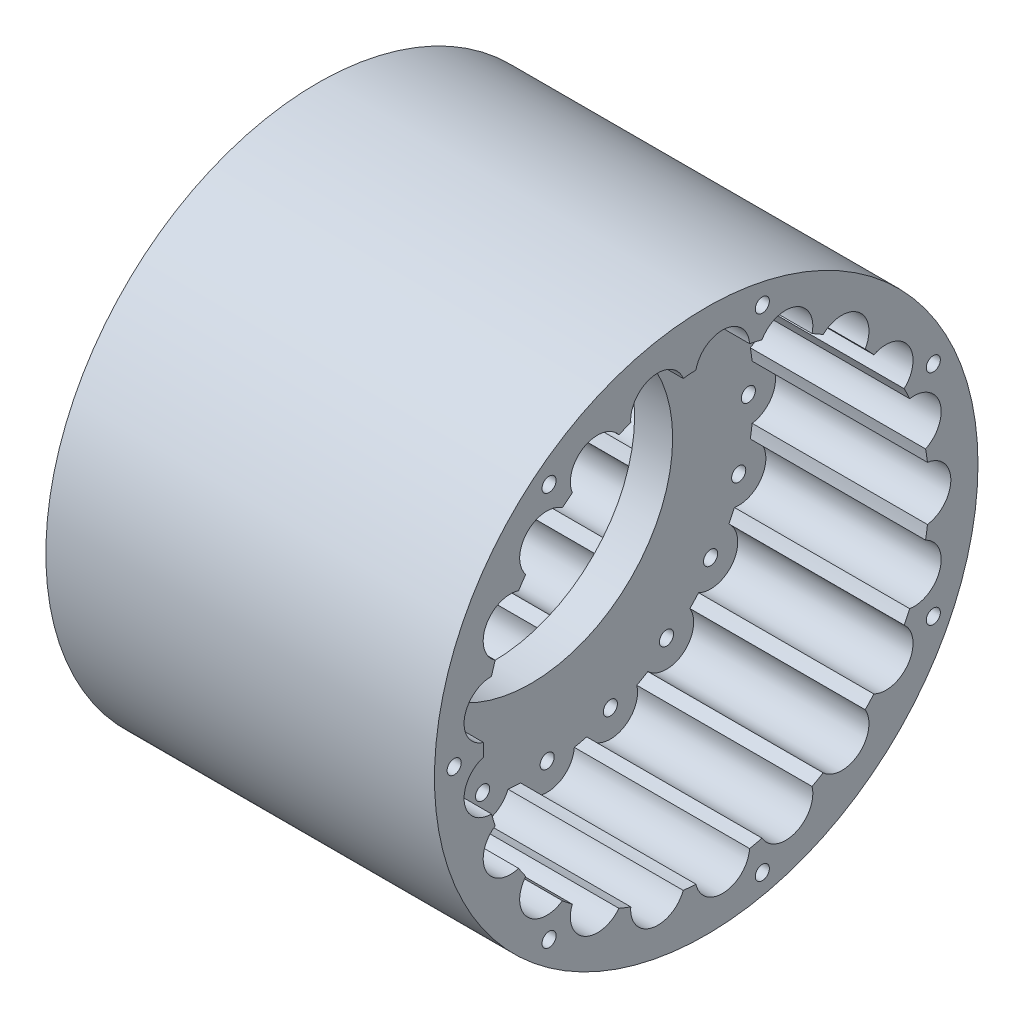
from build123d import *

# Parameters (mm, degrees)
SKIZZE4_R                        = 5
SCHNITT_LINEAR_AUSTRAGEN1_DEPTH  = 32.25
SKIZZE5_R                        = 1.3
SCHNITT_LINEAR_AUSTRAGEN2_DEPTH  = 13
F_2_6_2_6_DURCHMESSER_BOHRUNG1_D = 2.6
KREISMUSTER1_COUNT               = 21


with BuildPart() as part:
    # Skizze2 → Rotation1 (revolve)
    with BuildSketch(Plane.XY, mode=Mode.PRIVATE) as rotation1_sk:
        Polygon((0, 26.075), (3.5, 26.075), (3.5, 41), (35.75, 41), (35.75, 50), (0, 50), align=None)
    rotation1 = revolve(rotation1_sk.sketch.rotate(Axis((0, 0, 0), (-1, 0, 0)), 90), axis=Axis((0, 0, 0), (-1, 0, 0)))

    # Skizze4 → Schnitt-Linear austragen1 (cut)
    with BuildSketch(Plane(origin=(35.75, 0, 0), x_dir=(0, 0, -1), z_dir=(1, 0, 0))):
        with Locations((40, 0)):
            Circle(SKIZZE4_R)
        with Locations((38.222912231, -11.790206976)):
            Circle(SKIZZE4_R)
        with Locations((33.049550973, -22.532802323)):
            Circle(SKIZZE4_R)
        with Locations((24.939592074, -31.273259299)):
            Circle(SKIZZE4_R)
        with Locations((14.613640975, -37.234949946)):
            Circle(SKIZZE4_R)
        with Locations((2.989203743, -39.888151887)):
            Circle(SKIZZE4_R)
        with Locations((-8.900837358, -38.997116487)):
            Circle(SKIZZE4_R)
        with Locations((-20, -34.641016151)):
            Circle(SKIZZE4_R)
        with Locations((-29.322074873, -27.206909511)):
            Circle(SKIZZE4_R)
        with Locations((-36.038754716, -17.355349565)):
            Circle(SKIZZE4_R)
        with Locations((-39.553233049, -5.961690647)):
            Circle(SKIZZE4_R)
        with Locations((-39.553233049, 5.961690647)):
            Circle(SKIZZE4_R)
        with Locations((-36.038754716, 17.355349565)):
            Circle(SKIZZE4_R)
        with Locations((-29.322074873, 27.206909511)):
            Circle(SKIZZE4_R)
        with Locations((-20, 34.641016151)):
            Circle(SKIZZE4_R)
        with Locations((-8.900837358, 38.997116487)):
            Circle(SKIZZE4_R)
        with Locations((2.989203743, 39.888151887)):
            Circle(SKIZZE4_R)
        with Locations((14.613640975, 37.234949946)):
            Circle(SKIZZE4_R)
        with Locations((24.939592074, 31.273259299)):
            Circle(SKIZZE4_R)
        with Locations((33.049550973, 22.532802323)):
            Circle(SKIZZE4_R)
        with Locations((38.222912231, 11.790206976)):
            Circle(SKIZZE4_R)
    schnitt_linear_austragen1 = extrude(amount=-SCHNITT_LINEAR_AUSTRAGEN1_DEPTH, mode=Mode.SUBTRACT)

    # Skizze5 → Schnitt-Linear austragen2 (cut)
    with BuildSketch(Plane(origin=(35.75, 0, 0), x_dir=(0, 0, -1), z_dir=(1, 0, 0))):
        with Locations((-46.369838758, 0)):
            Circle(SKIZZE5_R)
        with Locations((-28.91112158, 36.253399778)):
            Circle(SKIZZE5_R)
        with Locations((10.318259828, 45.207250089)):
            Circle(SKIZZE5_R)
        with Locations((41.777781131, 20.119119023)):
            Circle(SKIZZE5_R)
        with Locations((41.777781131, -20.119119023)):
            Circle(SKIZZE5_R)
        with Locations((10.318259828, -45.207250089)):
            Circle(SKIZZE5_R)
        with Locations((-28.91112158, -36.253399778)):
            Circle(SKIZZE5_R)
    schnitt_linear_austragen2 = extrude(amount=-SCHNITT_LINEAR_AUSTRAGEN2_DEPTH, mode=Mode.SUBTRACT)

    # Spiegeln1: Rotation1, Schnitt-Linear austragen1, Schnitt-Linear austragen2 across plane
    add(rotation1.mirror(Plane(origin=(0, 0, 0), x_dir=(0, 0, 1), z_dir=(1, 0, 0))))
    add(schnitt_linear_austragen1.mirror(Plane(origin=(0, 0, 0), x_dir=(0, 0, 1), z_dir=(1, 0, 0))), mode=Mode.SUBTRACT)
    add(schnitt_linear_austragen2.mirror(Plane(origin=(0, 0, 0), x_dir=(0, 0, 1), z_dir=(1, 0, 0))), mode=Mode.SUBTRACT)

    # Ø2.6 (2.6) Durchmesser Bohrung1 (through all)
    with Locations(Plane(origin=(3.5, 0, 0), x_dir=(0, 0, -1), z_dir=(1, 0, 0))):
        with Locations((40, 0)):
            f_2_6_2_6_durchmesser_bohrung1 = Hole(F_2_6_2_6_DURCHMESSER_BOHRUNG1_D / 2)

    # Kreismuster1: Ø2.6 (2.6) Durchmesser Bohrung1 ×21 about axis
    kreismuster1_axis = Axis((0, 0, 0), (1, 0, 0))
    for i in range(1, KREISMUSTER1_COUNT):
        add(f_2_6_2_6_durchmesser_bohrung1.rotate(kreismuster1_axis, i * 360 / KREISMUSTER1_COUNT), mode=Mode.SUBTRACT)


solid = part.part
